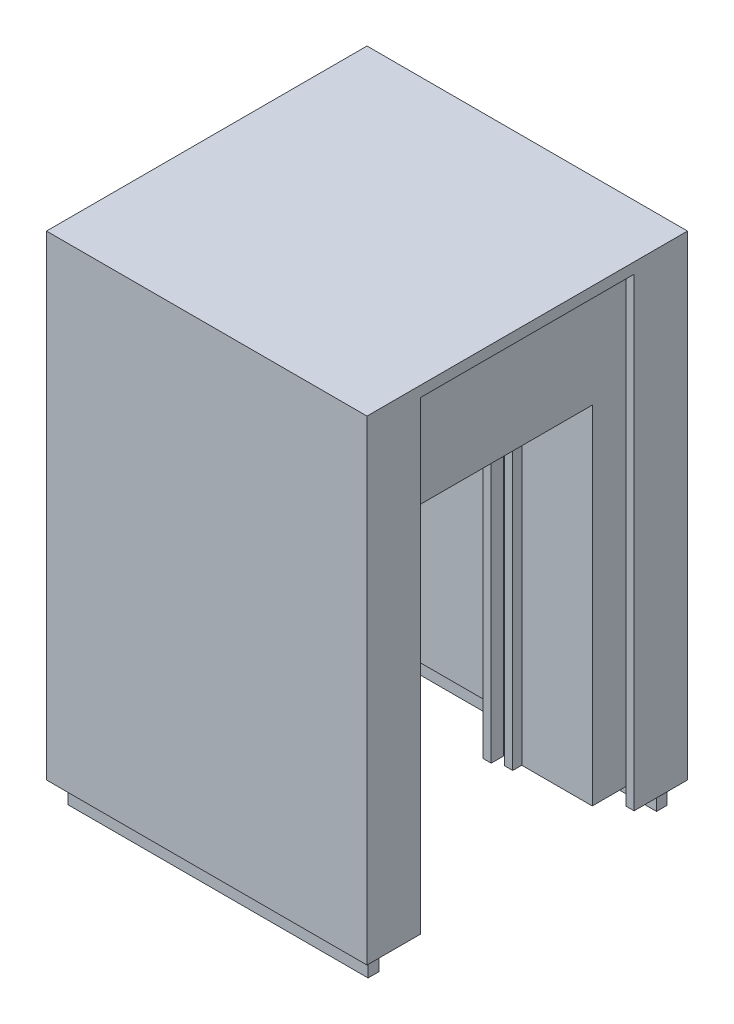
from build123d import *

# Parameters (mm, degrees)
BOSS_EXTRUDE1_DEPTH      = 0.0001
BOSS_EXTRUDE1_DEPTH_BACK = 87
SKETCH4_W                = 60
SKETCH4_H                = 60
BOSS_EXTRUDE2_DEPTH      = 2
SKETCH10_W               = 4.646690451
SKETCH10_H               = 22.0001
BOSS_EXTRUDE6_DEPTH      = 4
SKETCH12_W               = 5
SKETCH12_H               = 22.0001
BOSS_EXTRUDE7_DEPTH      = 33.742899166
BOSS_EXTRUDE8_DEPTH      = 4
SKETCH13_R               = 6.25
CUT_EXTRUDE1_DEPTH       = 10
SKETCH14_R               = 8.5
CUT_EXTRUDE2_DEPTH       = 10


with BuildPart() as part:
    # Sketch1 → Boss-Extrude1 (new, two sides: drawn at the far end of the back side and taken through both)
    with BuildSketch(Plane(origin=(0, 0, 0), x_dir=(1, 0, 0), z_dir=(0, 1, 0)).offset(-BOSS_EXTRUDE1_DEPTH_BACK)):
        Polygon((30, 20), (28.5, 20), (28.5, 23.5), (25.3, 23.5), (25.3, 16.871449583), (12.1, 16.871449583), (12.1, 15.181819085), (10.6, 15.181819085), (10.6, 16.685724792), (8.9, 16.685724792), (8.9, 14.346236409), (7.4, 14.346236409), (7.4, 24), (-24, 24), (-24, -24), (7.4, -24), (7.4, -14.346236409), (8.9, -14.346236409), (8.9, -16.685724792), (10.6, -16.685724792), (10.6, -15.181819085), (12.1, -15.181819085), (12.1, -16.871449583), (25.3, -16.871449583), (25.3, -23.5), (28.5, -23.5), (28.5, -20), (30, -20), (30, -30), (-30, -30), (-30, 30), (30, 30), align=None)
    extrude(amount=BOSS_EXTRUDE1_DEPTH + BOSS_EXTRUDE1_DEPTH_BACK)

    # Sketch4 → Boss-Extrude2 (add)
    with BuildSketch(Plane(origin=(0, 0.0001, 0), x_dir=(1, 0, 0), z_dir=(0, 1, 0))):
        Rectangle(SKETCH4_W, SKETCH4_H)
    extrude(amount=BOSS_EXTRUDE2_DEPTH)

    # Sketch10 → Boss-Extrude6 (add)
    with BuildSketch(Plane(origin=(0, 0, 16.871449583), x_dir=(-1, 0, 0), z_dir=(0, 0, -1))):
        with Locations((-9.776654775, -10.99995)):
            Rectangle(SKETCH10_W, SKETCH10_H)
    extrude(amount=BOSS_EXTRUDE6_DEPTH)

    # Sketch12 → Boss-Extrude7 (add)
    with BuildSketch(Plane(origin=(0, 0, 16.871449583), x_dir=(-1, 0, 0), z_dir=(0, 0, -1))):
        with Locations((-22.8, -10.99995)):
            Rectangle(SKETCH12_W, SKETCH12_H)
    extrude(amount=BOSS_EXTRUDE7_DEPTH)

    # Sketch6 → Boss-Extrude8 (add)
    with BuildSketch(Plane.XZ.offset(87)):
        Polygon((28.2, -28), (-28, -28), (-28, 28), (28.2, 28), (28.2, 26), (-26, 26), (-26, -26), (28.2, -26), align=None)
    extrude(amount=BOSS_EXTRUDE8_DEPTH)

    # Sketch13 → Cut-Extrude1 (cut)
    with BuildSketch(Plane.ZY.offset(30)):
        with Locations((14, -7.9999)):
            Circle(SKETCH13_R)
    extrude(amount=-CUT_EXTRUDE1_DEPTH, mode=Mode.SUBTRACT)

    # Sketch14 → Cut-Extrude2 (cut)
    with BuildSketch(Plane(origin=(0, 0, -30), x_dir=(-1, 0, 0), z_dir=(0, 0, -1))):
        with Locations((15, -12.9999)):
            Circle(SKETCH14_R)
        with Locations((15, -36.9999)):
            Circle(SKETCH14_R)
    extrude(amount=-CUT_EXTRUDE2_DEPTH, mode=Mode.SUBTRACT)


solid = part.part
